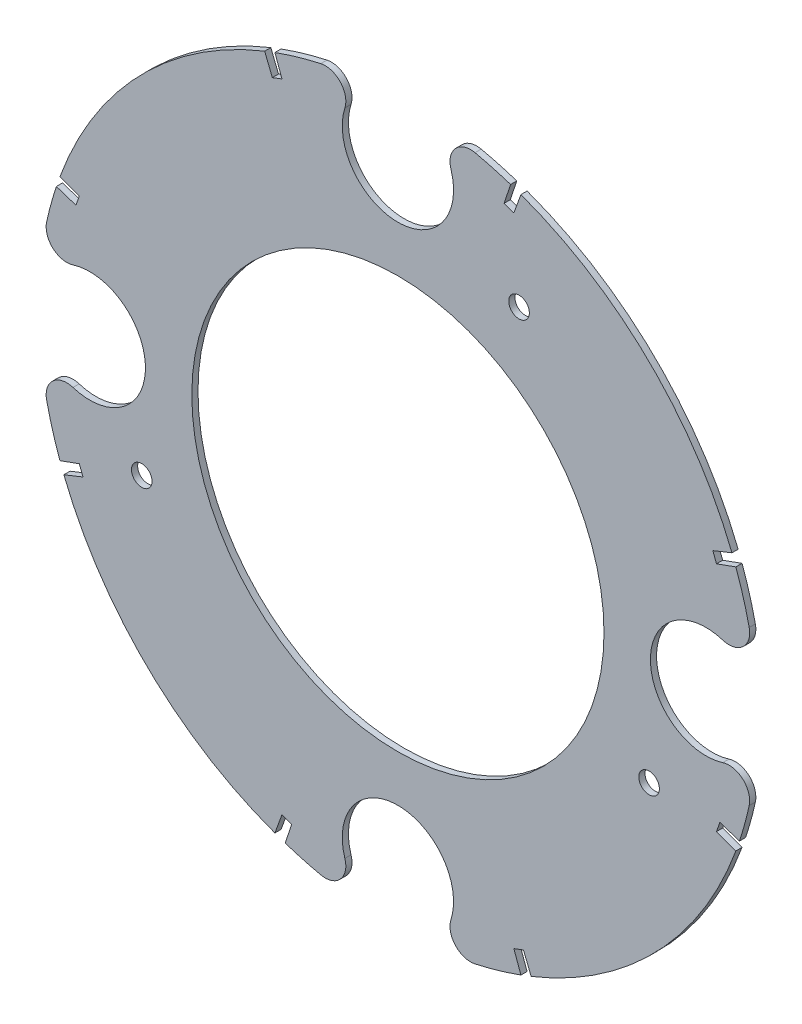
from build123d import *

# Parameters (mm, degrees)
SKETCH1_R           = 5
SKETCH1_R_2         = 100
BOSS_EXTRUDE1_DEPTH = 3


with BuildPart() as part:
    # Sketch1 → Boss-Extrude1 (new body)
    with BuildSketch(Plane.XY):
        with BuildLine():
            Line((-56.262313577, -154.579436119), (-51.538403725, -156.217934123))
            Line((-51.538403725, -156.217934123), (-54.671437386, -165.714465072))
            ThreePointArc((-54.671437386, -165.714465072), (-46.10465637, -168.299170114), (-37.416640882, -170.441324171))
            ThreePointArc((-37.416640882, -170.441324171), (-27.888102395, -167.417194297), (-25.739334079, -157.653936545))
            ThreePointArc((-25.739334079, -157.653936545), (0, -122.5), (25.739334079, -157.653936545))
            ThreePointArc((25.739334079, -157.653936545), (27.888102395, -167.417194297), (37.416640882, -170.441324171))
            ThreePointArc((37.416640882, -170.441324171), (48.657069904, -167.579054623), (59.68251501, -163.976362327))
            Line((59.68251501, -163.976362327), (56.262313577, -154.579436119))
            Line((56.262313577, -154.579436119), (60.934244684, -152.798127687))
            Line((60.934244684, -152.798127687), (64.638454088, -162.086767668))
            ThreePointArc((64.638454088, -162.086767668), (125.251113016, -121.500653037), (163.976362327, -59.68251501))
            Line((163.976362327, -59.68251501), (154.579436119, -56.262313577))
            Line((154.579436119, -56.262313577), (156.217934123, -51.538403725))
            Line((156.217934123, -51.538403725), (165.714465072, -54.671437386))
            ThreePointArc((165.714465072, -54.671437386), (168.299170114, -46.10465637), (170.441324171, -37.416640882))
            ThreePointArc((170.441324171, -37.416640882), (167.417194297, -27.888102395), (157.653936545, -25.739334079))
            ThreePointArc((157.653936545, -25.739334079), (122.5, 0), (157.653936545, 25.739334079))
            ThreePointArc((157.653936545, 25.739334079), (167.417194297, 27.888102395), (170.441324171, 37.416640882))
            ThreePointArc((170.441324171, 37.416640882), (167.579054623, 48.657069904), (163.976362327, 59.68251501))
            Line((163.976362327, 59.68251501), (154.579436119, 56.262313577))
            Line((154.579436119, 56.262313577), (152.798127687, 60.934244684))
            Line((152.798127687, 60.934244684), (162.086767668, 64.638454088))
            ThreePointArc((162.086767668, 64.638454088), (121.500653037, 125.251113016), (59.68251501, 163.976362327))
            Line((59.68251501, 163.976362327), (56.262313577, 154.579436119))
            Line((56.262313577, 154.579436119), (51.538403725, 156.217934123))
            Line((51.538403725, 156.217934123), (54.671437386, 165.714465072))
            ThreePointArc((54.671437386, 165.714465072), (46.10465637, 168.299170114), (37.416640882, 170.441324171))
            ThreePointArc((37.416640882, 170.441324171), (27.888102395, 167.417194297), (25.739334079, 157.653936545))
            ThreePointArc((25.739334079, 157.653936545), (0, 122.5), (-25.739334079, 157.653936545))
            ThreePointArc((-25.739334079, 157.653936545), (-27.888102395, 167.417194297), (-37.416640882, 170.441324171))
            ThreePointArc((-37.416640882, 170.441324171), (-48.657069904, 167.579054623), (-59.68251501, 163.976362327))
            Line((-59.68251501, 163.976362327), (-56.262313577, 154.579436119))
            Line((-56.262313577, 154.579436119), (-60.934244684, 152.798127687))
            Line((-60.934244684, 152.798127687), (-64.638454088, 162.086767668))
            ThreePointArc((-64.638454088, 162.086767668), (-125.251113016, 121.500653037), (-163.976362327, 59.68251501))
            Line((-163.976362327, 59.68251501), (-154.579436119, 56.262313577))
            Line((-154.579436119, 56.262313577), (-156.217934123, 51.538403725))
            Line((-156.217934123, 51.538403725), (-165.714465072, 54.671437386))
            ThreePointArc((-165.714465072, 54.671437386), (-168.299170114, 46.10465637), (-170.441324171, 37.416640882))
            ThreePointArc((-170.441324171, 37.416640882), (-167.417194297, 27.888102395), (-157.653936545, 25.739334079))
            ThreePointArc((-157.653936545, 25.739334079), (-122.5, 0), (-157.653936545, -25.739334079))
            ThreePointArc((-157.653936545, -25.739334079), (-167.417194297, -27.888102395), (-170.441324171, -37.416640882))
            ThreePointArc((-170.441324171, -37.416640882), (-167.579054623, -48.657069904), (-163.976362327, -59.68251501))
            Line((-163.976362327, -59.68251501), (-154.579436119, -56.262313577))
            Line((-154.579436119, -56.262313577), (-152.798127687, -60.934244684))
            Line((-152.798127687, -60.934244684), (-162.086767668, -64.638454088))
            ThreePointArc((-162.086767668, -64.638454088), (-121.500653037, -125.251113016), (-59.68251501, -163.976362327))
            Line((-59.68251501, -163.976362327), (-56.262313577, -154.579436119))
        make_face()
        with Locations((121.873399663, -52.131018514)):
            Circle(SKETCH1_R, mode=Mode.SUBTRACT)
        with Locations((58.775444452, 116.257983948)):
            Circle(SKETCH1_R, mode=Mode.SUBTRACT)
        with Locations((-124.289525039, -46.039349088)):
            Circle(SKETCH1_R, mode=Mode.SUBTRACT)
        Circle(SKETCH1_R_2, mode=Mode.SUBTRACT)
    extrude(amount=BOSS_EXTRUDE1_DEPTH)


solid = part.part
